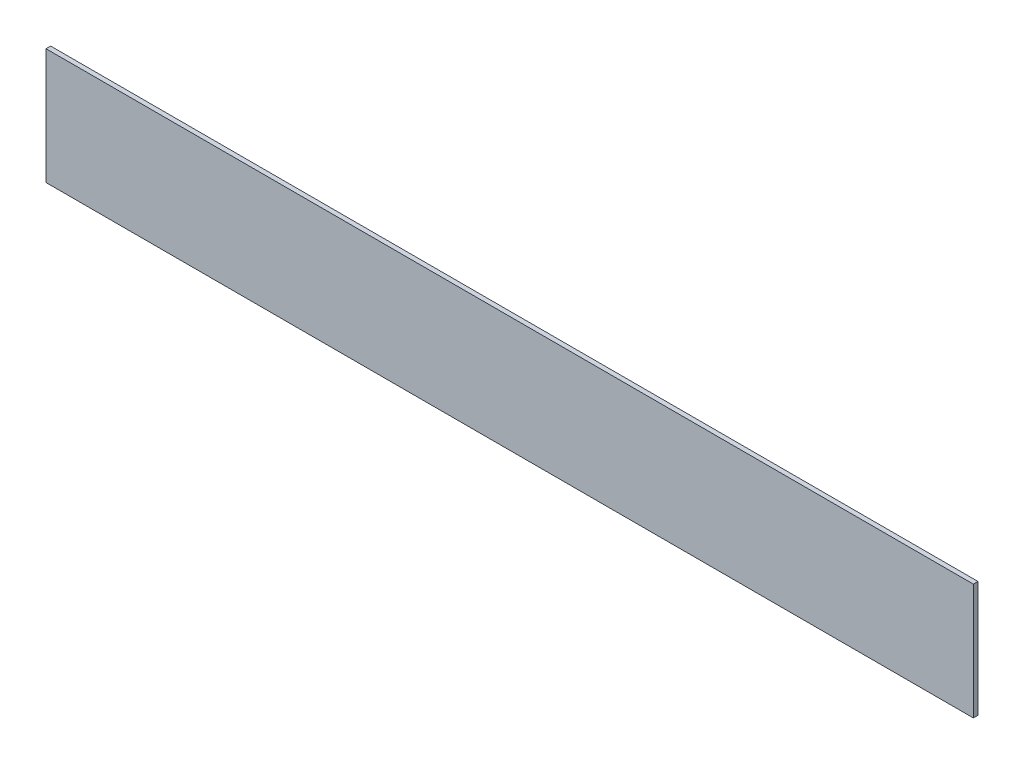
from build123d import *

# Parameters (mm, degrees)
SKETCH1_W           = 320
SKETCH1_H           = 40
KUTU_ON_DIL_1_DEPTH = 1.6


with BuildPart() as part:
    # Sketch1 → KUTU_on_dil_1 (new body)
    with BuildSketch(Plane.XY):
        with Locations((160, 61.6)):
            Rectangle(SKETCH1_W, SKETCH1_H)
    extrude(amount=KUTU_ON_DIL_1_DEPTH)


solid = part.part
